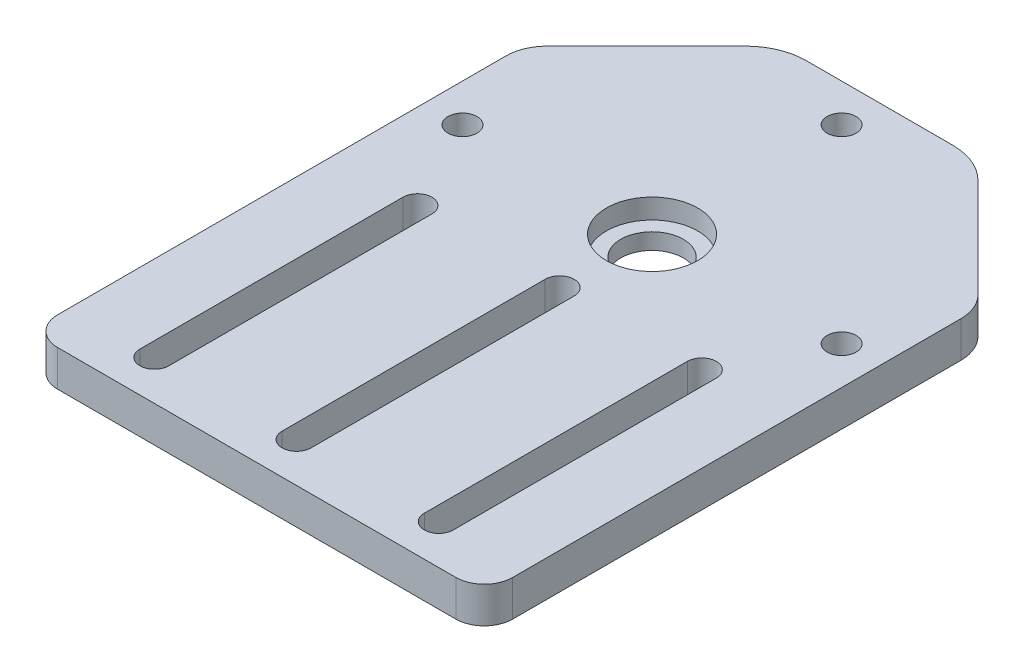
from build123d import *

# Parameters (mm, degrees)
SKETCH1_R           = 5.5
SKETCH1_R_2         = 2.55
BOSS_EXTRUDE1_DEPTH = 6.35
SKETCH2_R           = 8.025
CUT_EXTRUDE1_DEPTH  = 3.5


with BuildPart() as part:
    # Sketch1 → Boss-Extrude1 (new body)
    with BuildSketch(Plane(origin=(0, 0, 0), x_dir=(1, 0, 0), z_dir=(0, 1, 0))):
        with BuildLine():
            Line((40, -27.5), (40, 14.306951673))
            ThreePointArc((40, 14.306951673), (39.448126611, 17.081406557), (37.876524164, 19.433475836))
            Line((37.876524164, 19.433475836), (20.438099577, 36.871900423))
            ThreePointArc((20.438099577, 36.871900423), (16.973258212, 39.187033407), (12.886199154, 40))
            Line((12.886199154, 40), (-12.886199154, 40))
            ThreePointArc((-12.886199154, 40), (-16.973258212, 39.187033407), (-20.438099577, 36.871900423))
            Line((-20.438099577, 36.871900423), (-37.876524164, 19.433475836))
            ThreePointArc((-37.876524164, 19.433475836), (-39.448126611, 17.081406557), (-40, 14.306951673))
            Line((-40, 14.306951673), (-40, -27.5))
            Line((-40, -27.5), (-40, -64.5))
            ThreePointArc((-40, -64.5), (-38.535533906, -68.035533906), (-35, -69.5))
            Line((-35, -69.5), (35, -69.5))
            ThreePointArc((35, -69.5), (38.535533906, -68.035533906), (40, -64.5))
            Line((40, -64.5), (40, -27.5))
        make_face()
        with Locations(Location((0, 0, 0), (0, 0, 270))):
            Circle(SKETCH1_R, mode=Mode.SUBTRACT)
        with Locations(Location((-33.333013665, 0, 0), (0, 0, 270))):
            Circle(SKETCH1_R_2, mode=Mode.SUBTRACT)
        with Locations(Location((0, 33.333013665, 0), (0, 0, 270))):
            Circle(SKETCH1_R_2, mode=Mode.SUBTRACT)
        with Locations(Location((33.333013665, 0, 0), (0, 0, 90))):
            Circle(SKETCH1_R_2, mode=Mode.SUBTRACT)
        with BuildLine():
            Line((22.45, -62.5), (22.45, -16.25))
            ThreePointArc((22.45, -16.25), (25, -13.7), (27.55, -16.25))
            Line((27.55, -16.25), (27.55, -62.5))
            ThreePointArc((27.55, -62.5), (25, -65.05), (22.45, -62.5))
        make_face(mode=Mode.SUBTRACT)
        with BuildLine():
            Line((-2.55, -62.5), (-2.55, -16.25))
            ThreePointArc((-2.55, -16.25), (0, -13.7), (2.55, -16.25))
            Line((2.55, -16.25), (2.55, -62.5))
            ThreePointArc((2.55, -62.5), (0, -65.05), (-2.55, -62.5))
        make_face(mode=Mode.SUBTRACT)
        with BuildLine():
            Line((-27.55, -62.5), (-27.55, -16.25))
            ThreePointArc((-27.55, -16.25), (-25, -13.7), (-22.45, -16.25))
            Line((-22.45, -16.25), (-22.45, -62.5))
            ThreePointArc((-22.45, -62.5), (-25, -65.05), (-27.55, -62.5))
        make_face(mode=Mode.SUBTRACT)
    extrude(amount=BOSS_EXTRUDE1_DEPTH)

    # Sketch2 → Cut-Extrude1 (cut)
    with BuildSketch(Plane(origin=(0, 6.35, 0), x_dir=(1, 0, 0), z_dir=(0, 1, 0))):
        with Locations(Location((0, 0, 0), (0, 0, 270))):
            Circle(SKETCH2_R)
    extrude(amount=-CUT_EXTRUDE1_DEPTH, mode=Mode.SUBTRACT)


solid = part.part
